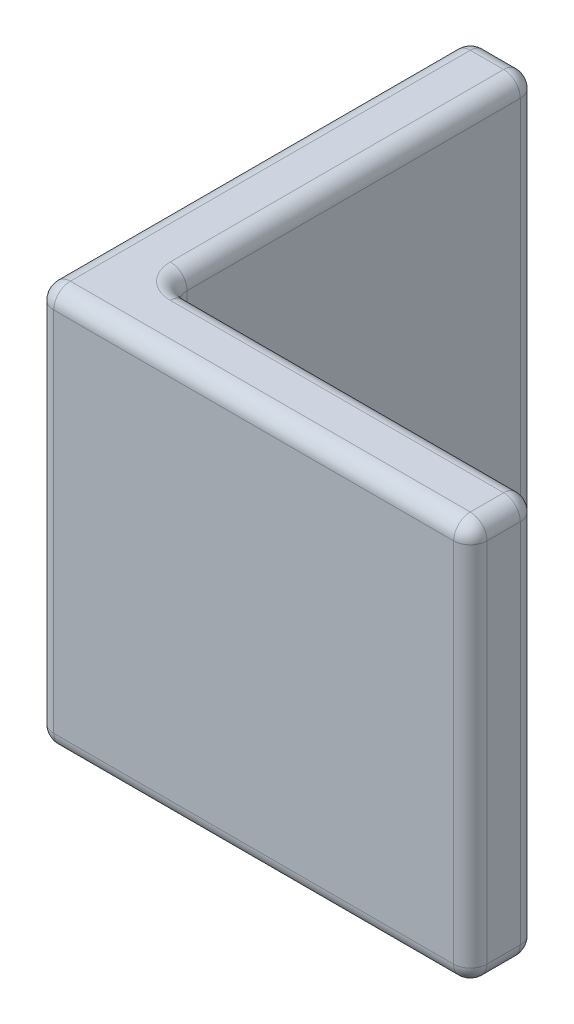
from build123d import *

# Parameters (mm, degrees)
BOSS_EXTRUDE1_DEPTH = 1828.8
FILLET1_R           = 76.2


with BuildPart() as part:
    # Sketch1 → Boss-Extrude1 (new body)
    with BuildSketch(Plane(origin=(0, 0, 0), x_dir=(1, 0, 0), z_dir=(0, 1, 0))):
        Polygon((304.8, 1981.2), (304.8, 304.8), (1981.2, 304.8), (1981.2, 0), (0, 0), (0, 1981.2), align=None)
    extrude(amount=BOSS_EXTRUDE1_DEPTH)

    # Fillet1
    fillet1_edges = [part.edges().sort_by_distance(p)[0] for p in [
        (1981.2, 1828.8, -152.4),
        (0, 914.4, -1981.2),
        (304.8, 914.4, -1981.2),
        (304.8, 914.4, -304.8),
        (1981.2, 914.4, -304.8),
        (1981.2, 914.4, 0),
        (0, 914.4, 0),
        (1143, 1828.8, -304.8),
        (304.8, 1828.8, -1143),
        (152.4, 1828.8, -1981.2),
        (0, 1828.8, -990.6),
        (152.4, 0, -1981.2),
        (304.8, 0, -1143),
        (1143, 0, -304.8),
        (990.6, 1828.8, 0),
        (1981.2, 0, -152.4),
        (990.6, 0, 0),
        (0, 0, -990.6),
    ]]
    fillet(fillet1_edges, radius=FILLET1_R)


solid = part.part
